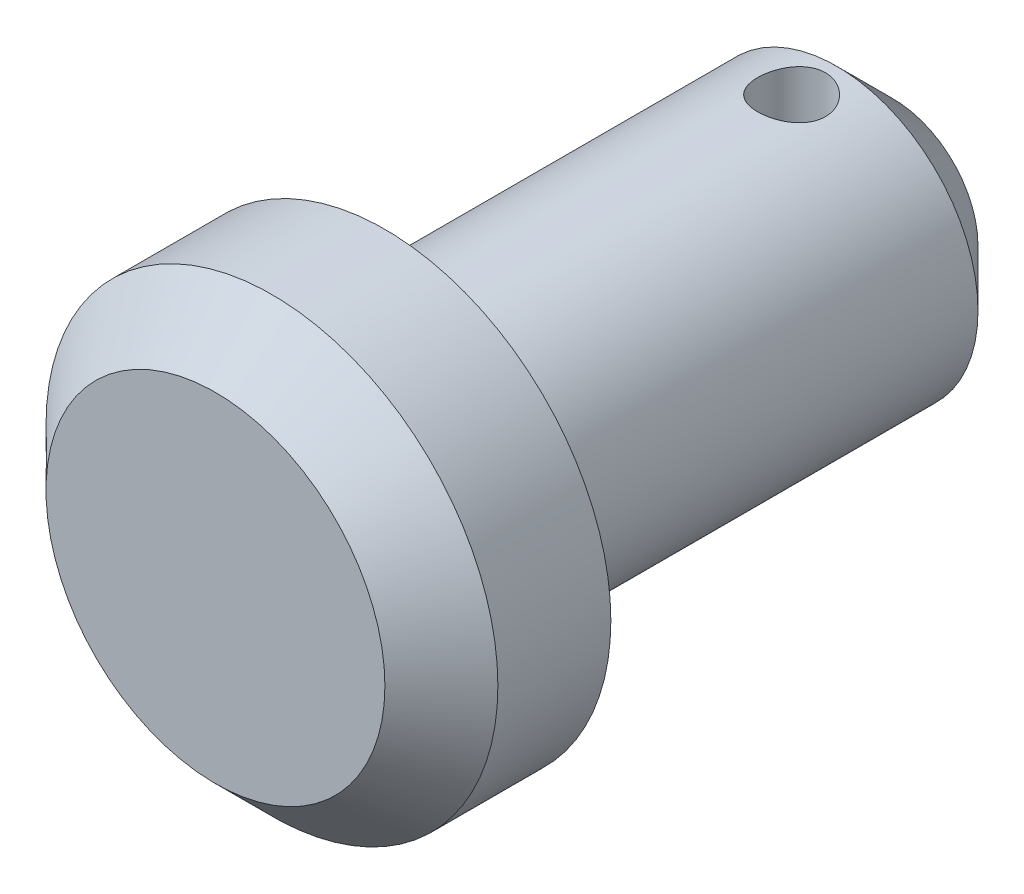
from build123d import *

# Parameters (mm, degrees)
CUT_EXTRUDE1_DEPTH      = 133.664991614
CUT_EXTRUDE1_DEPTH_BACK = 133.664991614
SKETCH2_R               = 6


with BuildPart() as part:
    # Sketch1 → Revolve1 (revolve)
    with BuildSketch(Plane(origin=(0, 0, 0), x_dir=(0, 0, -1), z_dir=(1, 0, 0)), mode=Mode.PRIVATE) as revolve1_sk:
        Polygon((0, 0), (120, 0), (120, 15), (110, 25), (30, 25), (30, 40), (10, 40), (0, 30), align=None)
    revolve(revolve1_sk.sketch.rotate(Axis((0, 0, 0), (0, 0, -1)), 90), axis=Axis((0, 0, 0), (0, 0, -1)))

    # Sketch2 → Cut-Extrude1 (cut, two sides: drawn at the far end of the back side and taken through both)
    with BuildSketch(Plane(origin=(0, 0, 0), x_dir=(1, 0, 0), z_dir=(0, 1, 0)).offset(-CUT_EXTRUDE1_DEPTH_BACK)):
        with Locations(Location((0, 102, 0), (0, 0, 270))):
            Circle(SKETCH2_R)
    extrude(amount=CUT_EXTRUDE1_DEPTH + CUT_EXTRUDE1_DEPTH_BACK, mode=Mode.SUBTRACT)


solid = part.part
